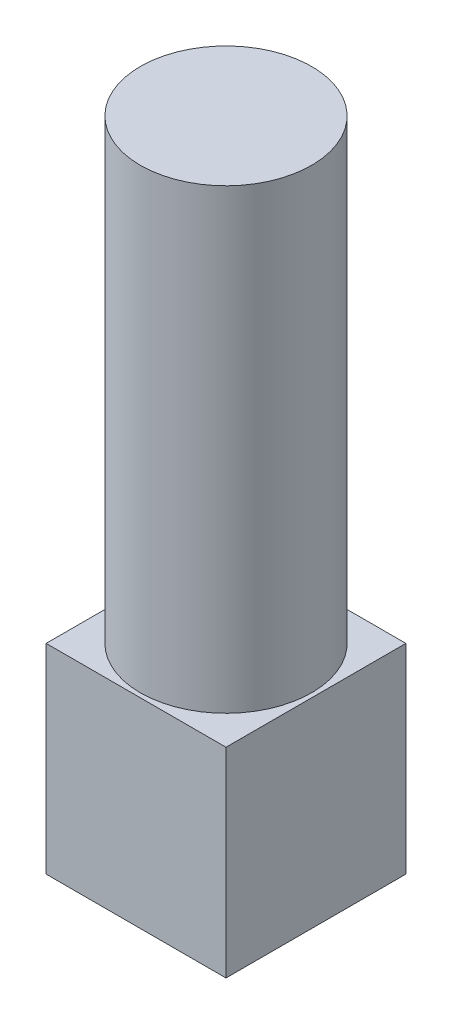
from build123d import *

# Parameters (mm, degrees)
SKETCH1_W           = 3.15
SKETCH1_H           = 3.15
BOSS_EXTRUDE1_DEPTH = 3.5
SKETCH3_R           = 1.5
BOSS_EXTRUDE3_DEPTH = 8


with BuildPart() as part:
    # Sketch1 → Boss-Extrude1 (new body)
    with BuildSketch(Plane(origin=(0, 0, 0), x_dir=(1, 0, 0), z_dir=(0, 1, 0))):
        with Locations((-63.242776495, -13.488286087)):
            Rectangle(SKETCH1_W, SKETCH1_H)
    extrude(amount=BOSS_EXTRUDE1_DEPTH)

    # Sketch3 → Boss-Extrude3 (add)
    with BuildSketch(Plane(origin=(0, 3.5, 0), x_dir=(1, 0, 0), z_dir=(0, 1, 0))):
        with Locations(Location((-63.242776495, -13.488286087, 0), (0, 0, 270))):
            Circle(SKETCH3_R)
    extrude(amount=BOSS_EXTRUDE3_DEPTH)


solid = part.part
